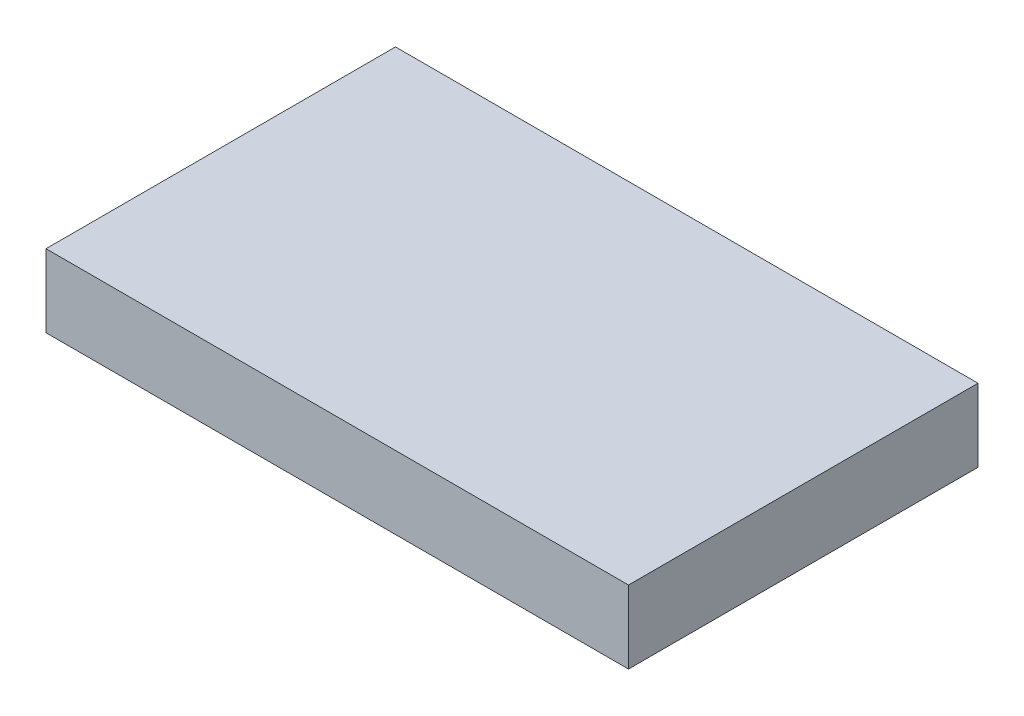
from build123d import *

# Parameters (mm, degrees)
SKETCH_1_W      = 200
SKETCH_1_H      = 120
EXTRUDE_1_DEPTH = 25


with BuildPart() as part:
    # 草图1 → 凸台-拉伸1 (new body)
    with BuildSketch(Plane(origin=(0, 0, 0), x_dir=(1, 0, 0), z_dir=(0, 1, 0))):
        Rectangle(SKETCH_1_W, SKETCH_1_H)
    extrude(amount=-EXTRUDE_1_DEPTH)


solid = part.part
